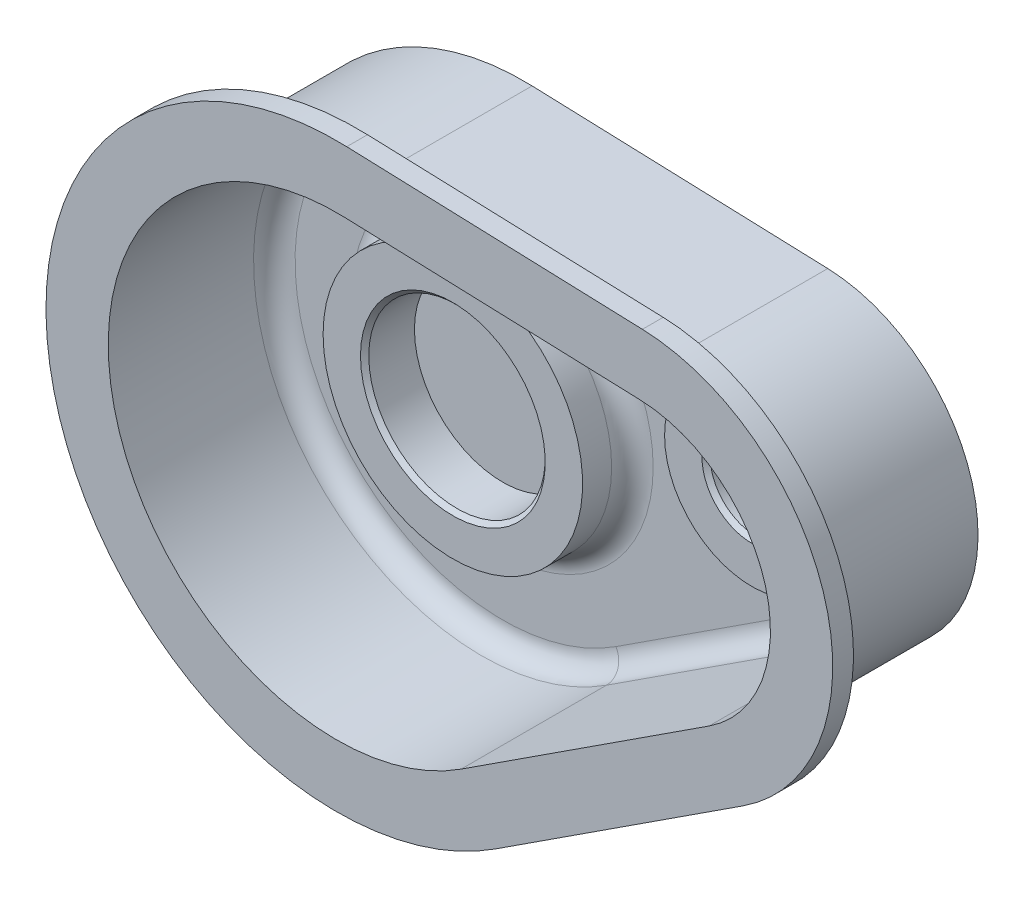
from build123d import *

# Parameters (mm, degrees)
BOSS_EXTRUDE4_DEPTH = 45
SHELL3_T            = -5
BOSS_EXTRUDE5_START = -5
BOSS_EXTRUDE5_DEPTH = 5
SKETCH10_R          = 31.25
SKETCH10_R_2        = 21.25
SKETCH10_R_3        = 21
SKETCH10_R_4        = 11
BOSS_EXTRUDE6_DEPTH = 12
FILLET2_R           = 5
CHAMFER1_SIZE       = 1


with BuildPart() as part:
    # Sketch8 → Boss-Extrude4 (new body)
    with BuildSketch(Plane.XY):
        with BuildLine():
            Line((2.09348148, 59.963466672), (73.308425925, 57.47716667))
            ThreePointArc((73.308425925, 57.47716667), (108.131921611, 30.036644892), (92.450170063, -11.433112229))
            Line((92.450170063, -11.433112229), (32.720272102, -50.292979566))
            ThreePointArc((32.720272102, -50.292979566), (-57.811074578, -16.058631827), (2.09348148, 59.963466672))
        make_face()
    extrude(amount=BOSS_EXTRUDE4_DEPTH)

    # Shell3
    shell3_openings = [part.faces().sort_by_distance(p)[0] for p in [
        (19.954889275, 5.543024799, 45),
    ]]
    offset(amount=SHELL3_T, openings=shell3_openings, kind=Kind.INTERSECTION)

    # Sketch9 → Boss-Extrude5 (add)
    with BuildSketch(Plane.XY.offset(45).offset(BOSS_EXTRUDE5_START)):
        with BuildLine():
            Line((73.657339505, 67.471077782), (2.44239506, 69.957377784))
            ThreePointArc((2.44239506, 69.957377784), (-67.446253674, -18.735070465), (38.173650785, -58.675142827))
            Line((38.173650785, -58.675142827), (97.903548747, -19.81527549))
            ThreePointArc((97.903548747, -19.81527549), (117.767100707, 32.71308353), (73.657339505, 67.471077782))
        make_face()
        with BuildLine():
            Line((32.720272102, -50.292979566), (92.450170063, -11.433112229))
            ThreePointArc((92.450170063, -11.433112229), (108.131921611, 30.036644892), (73.308425925, 57.47716667))
            Line((73.308425925, 57.47716667), (2.09348148, 59.963466672))
            ThreePointArc((2.09348148, 59.963466672), (-57.811074578, -16.058631827), (32.720272102, -50.292979566))
        make_face(mode=Mode.SUBTRACT)
    extrude(amount=BOSS_EXTRUDE5_DEPTH)

    # Sketch10 → Boss-Extrude6 (add)
    # profile 1 of 2: a face of its own
    with BuildSketch(Plane(origin=(0, 0, 5), x_dir=(-1, 0, 0), z_dir=(0, 0, -1))):
        Circle(SKETCH10_R)
        Circle(SKETCH10_R_2, mode=Mode.SUBTRACT)
    # profile 2 of 2: a face of its own
    with BuildSketch(Plane(origin=(0, 0, 5), x_dir=(-1, 0, 0), z_dir=(0, 0, -1))):
        with Locations((-72, 20)):
            Circle(SKETCH10_R_3)
        with Locations((-72, 20)):
            Circle(SKETCH10_R_4, mode=Mode.SUBTRACT)
    extrude(amount=-BOSS_EXTRUDE6_DEPTH)

    # Fillet2
    fillet2_edges = [part.edges().sort_by_distance(p)[0] for p in [
        (-52.99348503, -14.720412508, 5),
        (59.858531741, -26.671964267, 5),
        (103.314332063, 28.698425573, 5),
        (37.526496913, 53.723361115, 5),
        (31.25, 0, 5),
    ]]
    fillet(fillet2_edges, radius=FILLET2_R)

    # Chamfer1
    chamfer1_edges = [part.edges().sort_by_distance(p)[0] for p in [
        (21.25, 0, 17),
        (83, 20, 17),
    ]]
    chamfer(chamfer1_edges, length=CHAMFER1_SIZE)


solid = part.part
